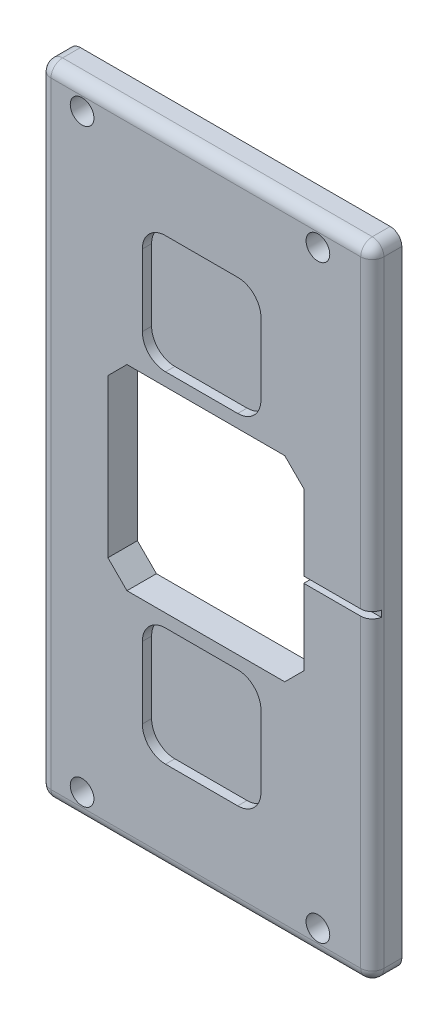
from build123d import *

# Parameters (mm, degrees)
BOSS_EXTRUDE3_DEPTH  = 6.35
SKETCH6_R            = 2.5527
CUT_EXTRUDE5_DEPTH   = 6.35
FILLET2_R            = 2.5
SKETCH7_R            = 3.43
CUT_EXTRUDE6_DEPTH   = 144.750797039
SKETCH10_W           = 42.1894
SKETCH10_H           = 42.1894
CUT_EXTRUDE8_DEPTH   = 144.750797039
CUT_EXTRUDE9_DEPTH   = 2
SKETCH12_W           = 25.550132031
SKETCH12_H           = 25.4
CUT_EXTRUDE10_DEPTH  = 2
FILLET3_R            = 5
FILLET3_OF_MIRROR1_R = 5
CHAMFER1_SIZE        = 4.1


with BuildPart() as part:
    # Sketch1 → Boss-Extrude3 (new body)
    with BuildSketch(Plane.XY):
        Polygon((126.019412193, 68.87), (68.0566, 68.87), (62.2146, 68.87), (54.299929099, 68.87), (54.299929099, -68.87), (62.2146, -68.87), (126.019412193, -68.87), align=None)
    extrude(amount=BOSS_EXTRUDE3_DEPTH)

    # Sketch6 → Cut-Extrude5 (cut)
    with BuildSketch(Plane(origin=(0, 0, 0), x_dir=(-1, 0, 0), z_dir=(0, 0, -1))):
        with Locations((-114.3, -63.5)):
            Circle(SKETCH6_R)
        with Locations((-63.5, -63.5)):
            Circle(SKETCH6_R)
        with Locations((-63.5, 63.5)):
            Circle(SKETCH6_R)
        with Locations((-114.3, 63.5)):
            Circle(SKETCH6_R)
    extrude(amount=-CUT_EXTRUDE5_DEPTH, mode=Mode.SUBTRACT)

    # Fillet2
    fillet2_edges = [part.edges().sort_by_distance(p)[0] for p in [
        (54.299929099, 68.87, 3.175),
        (54.299929099, 0, 6.35),
        (90.159670646, -68.87, 6.35),
        (126.019412193, 0, 6.35),
        (90.159670646, 68.87, 6.35),
        (126.019412193, 68.87, 3.175),
        (126.019412193, -68.87, 3.175),
        (54.299929099, -68.87, 3.175),
    ]]
    fillet(fillet2_edges, radius=FILLET2_R)

    # Sketch7 → Cut-Extrude6 (cut, through all)
    with BuildSketch(Plane.XY.offset(6.35)):
        with Locations((90.159670646, 0)):
            Circle(SKETCH7_R)
    extrude(amount=-CUT_EXTRUDE6_DEPTH, mode=Mode.SUBTRACT)

    # Sketch10 → Cut-Extrude8 (cut, through all)
    with BuildSketch(Plane.XY.offset(6.35)):
        with Locations((90.159670646, 0)):
            Rectangle(SKETCH10_W, SKETCH10_H)
    extrude(amount=-CUT_EXTRUDE8_DEPTH, mode=Mode.SUBTRACT)

    # Sketch11 → Cut-Extrude9 (cut)
    with BuildSketch(Plane.XY.offset(6.35)):
        Polygon((123.519412193, -0.667001733), (111.254370646, -0.667001733), (111.254370646, 0.684203883), (123.519412193, 0.684203883), (127.39852583, 0.684203883), (127.39852583, -0.667001733), align=None)
    extrude(amount=-CUT_EXTRUDE9_DEPTH, mode=Mode.SUBTRACT)

    # Sketch12 → Cut-Extrude10 (cut)
    with BuildSketch(Plane.XY.offset(6.35)):
        with Locations((89.249266016, -36.599999996)):
            Rectangle(SKETCH12_W, SKETCH12_H)
    cut_extrude10 = extrude(amount=-CUT_EXTRUDE10_DEPTH, mode=Mode.SUBTRACT)

    # Fillet3
    fillet3_edges = [part.edges().sort_by_distance(p)[0] for p in [
        (76.4742, -49.299999996, 5.35),
        (76.4742, -23.899999996, 5.35),
        (102.024332031, -23.899999996, 5.35),
        (102.024332031, -49.299999996, 5.35),
    ]]
    fillet(fillet3_edges, radius=FILLET3_R)

    # Mirror1: Cut-Extrude10 across plane
    add(cut_extrude10.mirror(Plane(origin=(0, 0, 0), x_dir=(0, 0, 1), z_dir=(0, -1, 0))), mode=Mode.SUBTRACT)

    # Fillet3 of Mirror1
    fillet3_of_mirror1_edges = [part.edges().sort_by_distance(p)[0] for p in [
        (76.4742, 49.299999996, 5.35),
        (76.4742, 23.899999996, 5.35),
        (102.024332031, 23.899999996, 5.35),
        (102.024332031, 49.299999996, 5.35),
    ]]
    fillet(fillet3_of_mirror1_edges, radius=FILLET3_OF_MIRROR1_R)

    # Chamfer1
    chamfer1_edges = [part.edges().sort_by_distance(p)[0] for p in [
        (111.254370646, 21.0947, 3.175),
        (111.254370646, -21.0947, 3.175),
        (69.064970646, -21.0947, 3.175),
        (69.064970646, 21.0947, 3.175),
    ]]
    chamfer(chamfer1_edges, length=CHAMFER1_SIZE)


solid = part.part
